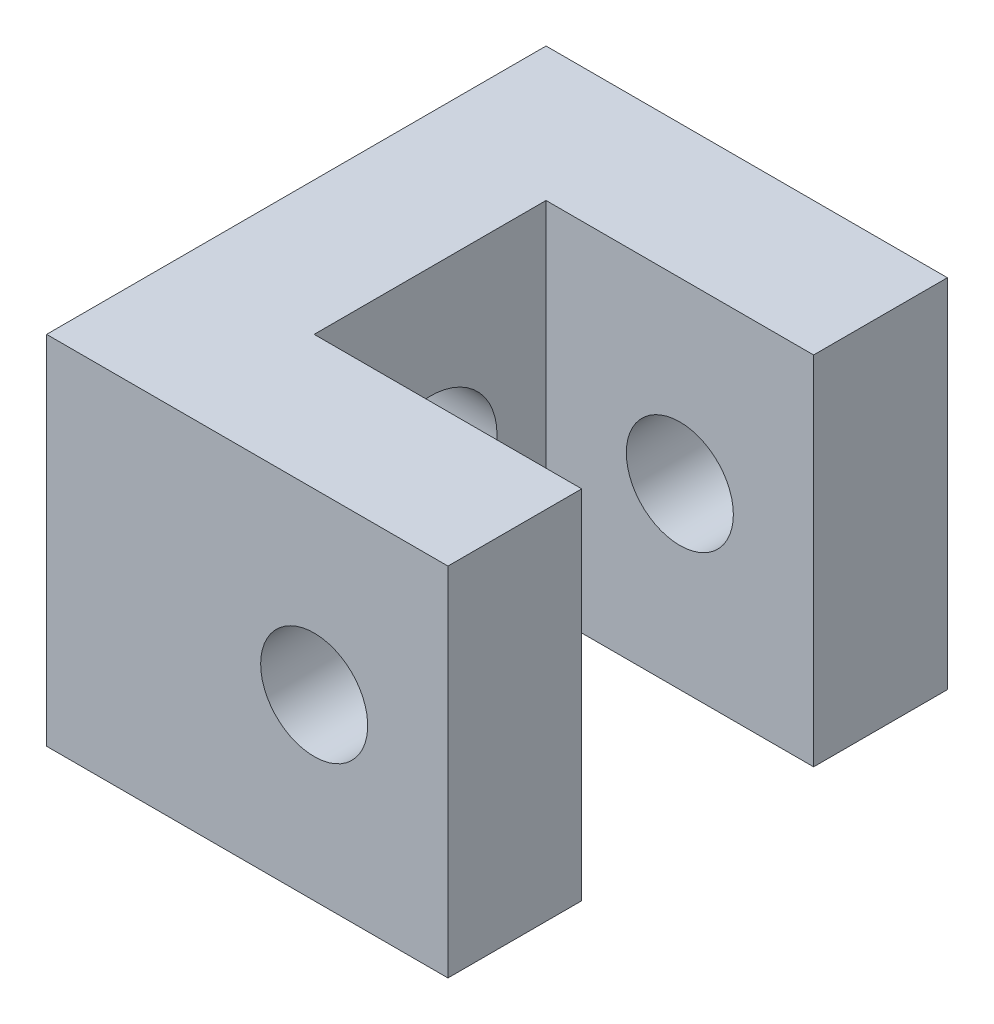
from build123d import *

# Parameters (mm, degrees)
SKETCH1_W               = 56
SKETCH1_H               = 40
SKETCH1_R               = 7.5
BOSS_EXTRUDE1_DEPTH     = 15
SKETCH1_3_W             = 15
SKETCH1_3_H             = 40
BOSS_EXTRUDE2_DEPTH     = 30
CUT_EXTRUDE1_DEPTH      = 55.598534779
CUT_EXTRUDE1_DEPTH_BACK = 55.598534779
SKETCH2_R               = 6


with BuildPart() as part:
    # Sketch1 → Boss-Extrude1 (new body)
    with BuildSketch(Plane(origin=(0, 0, 0), x_dir=(0, 0, -1), z_dir=(1, 0, 0))):
        Rectangle(SKETCH1_W, SKETCH1_H)
        Circle(SKETCH1_R, mode=Mode.SUBTRACT)
    extrude(amount=-BOSS_EXTRUDE1_DEPTH)

    # Sketch1<3> → Boss-Extrude2 (add)
    with BuildSketch(Plane(origin=(0, 0, 0), x_dir=(0, 0, -1), z_dir=(1, 0, 0))):
        with Locations((-20.5, 0)):
            Rectangle(SKETCH1_3_W, SKETCH1_3_H)
        with Locations((20.5, 0)):
            Rectangle(SKETCH1_3_W, SKETCH1_3_H)
    extrude(amount=BOSS_EXTRUDE2_DEPTH)

    # Sketch2 → Cut-Extrude1 (cut, two sides: drawn at the far end of the back side and taken through both)
    with BuildSketch(Plane(origin=(0, 0, 13), x_dir=(-1, 0, 0), z_dir=(0, 0, -1)).offset(-CUT_EXTRUDE1_DEPTH_BACK)):
        with Locations((-15, 0)):
            Circle(SKETCH2_R)
    extrude(amount=CUT_EXTRUDE1_DEPTH + CUT_EXTRUDE1_DEPTH_BACK, mode=Mode.SUBTRACT)


solid = part.part
